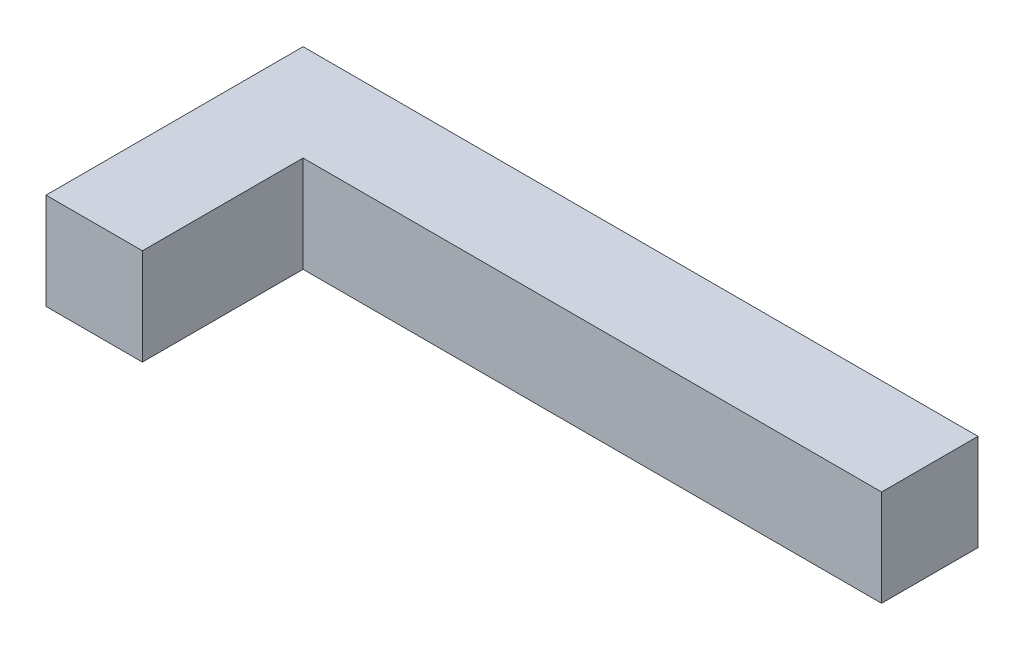
from build123d import *

# Parameters (mm, degrees)
ESBO_O1_W                = 15
ESBO_O1_H                = 15
RESSALTO_EXTRUS_O1_DEPTH = 40
ESBO_O2_W                = 15
ESBO_O2_H                = 15
RESSALTO_EXTRUS_O2_DEPTH = 90


with BuildPart() as part:
    # Esboço1 → Ressalto-extrusão1 (new body)
    with BuildSketch(Plane.XY):
        with Locations((7.5, -7.5)):
            Rectangle(ESBO_O1_W, ESBO_O1_H)
    extrude(amount=RESSALTO_EXTRUS_O1_DEPTH)

    # Esboço2 → Ressalto-extrusão2 (add)
    with BuildSketch(Plane(origin=(15, 0, 0), x_dir=(0, 0, -1), z_dir=(1, 0, 0))):
        with Locations((-7.5, -7.5)):
            Rectangle(ESBO_O2_W, ESBO_O2_H)
    extrude(amount=RESSALTO_EXTRUS_O2_DEPTH)


solid = part.part
